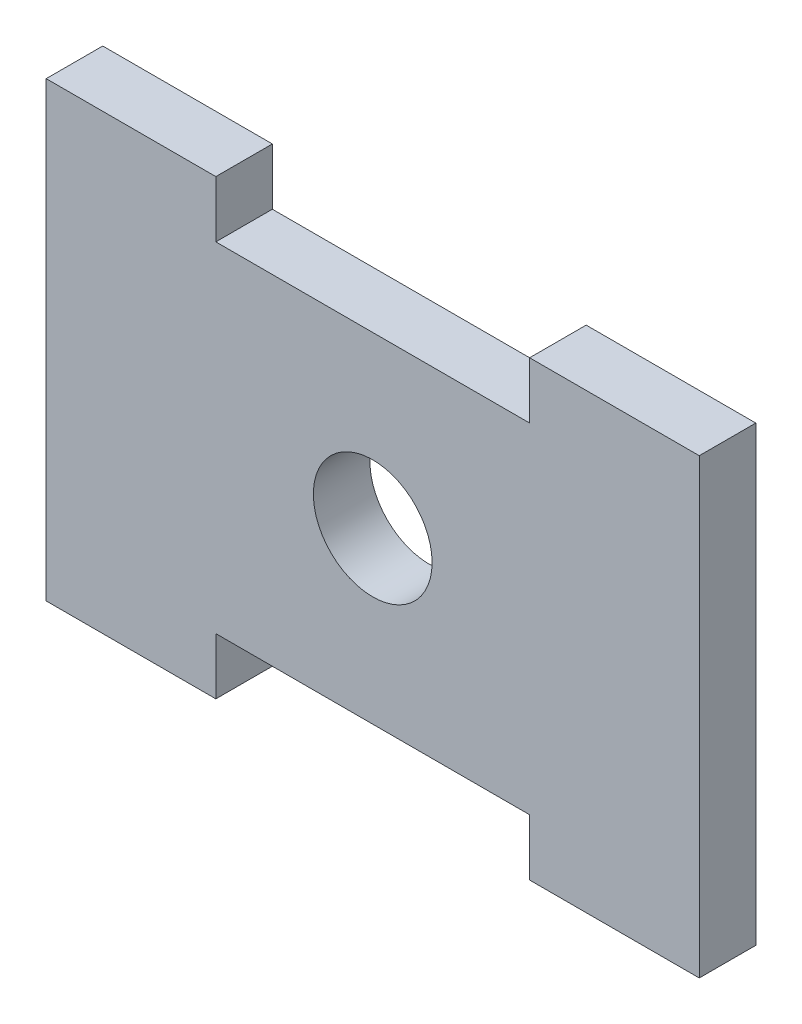
from build123d import *

# Parameters (mm, degrees)
SKETCH_1_R      = 2.1
EXTRUDE_1_DEPTH = 2


with BuildPart() as part:
    # 草图1 → 凸台-拉伸1 (new body)
    with BuildSketch(Plane.XY):
        Polygon((-3, 1), (3, 1), (3, -1), (14.1, -1), (14.1, 1), (20.1, 1), (20.1, -1), (20.1, -13), (20.1, -15), (14.1, -15), (14.1, -13), (3, -13), (3, -15), (-3, -15), (-3, -13), (-3, -1), align=None)
        with Locations((8.55, -7)):
            Circle(SKETCH_1_R, mode=Mode.SUBTRACT)
    extrude(amount=EXTRUDE_1_DEPTH)


solid = part.part
